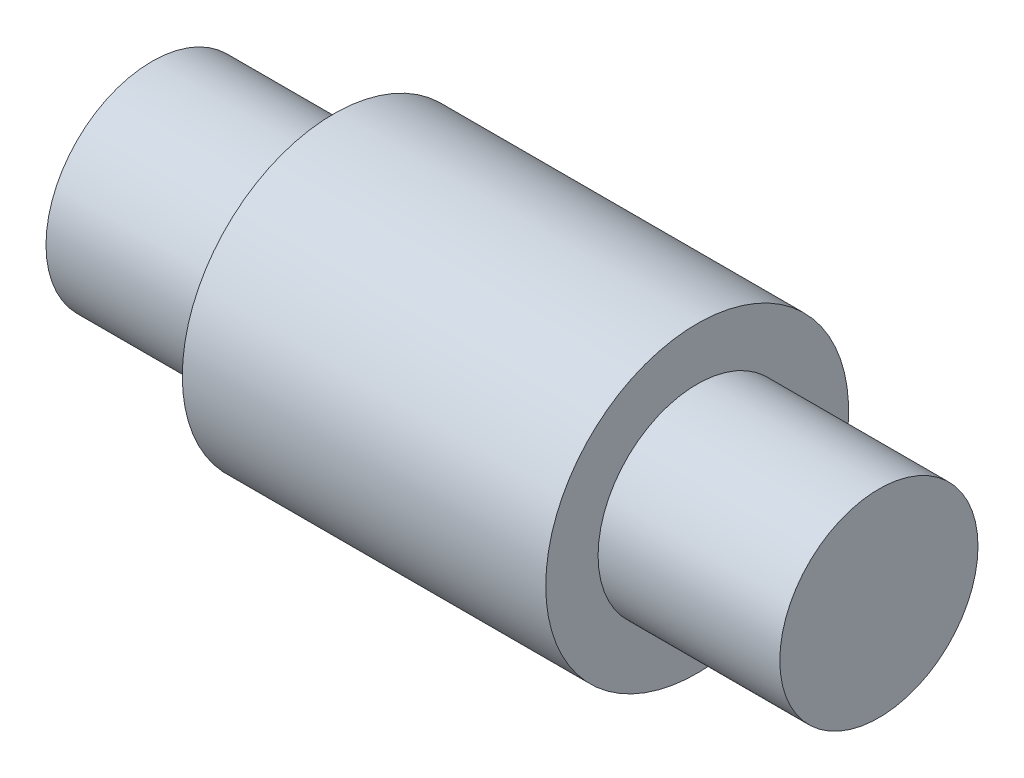
from build123d import *


with BuildPart() as part:
    # Sketch1 → Revolve1 (revolve)
    with BuildSketch(Plane.XY, mode=Mode.PRIVATE) as revolve1_sk:
        Polygon((-12, 0), (12, 0), (12, 3.272063637), (6, 3.272063637), (6, 5), (-6, 5), (-6, 3.5), (-12, 3.5), align=None)
    revolve(revolve1_sk.sketch.rotate(Axis((-12, 0, 0), (1, 0, 0)), 90), axis=Axis((-12, 0, 0), (1, 0, 0)))


solid = part.part
